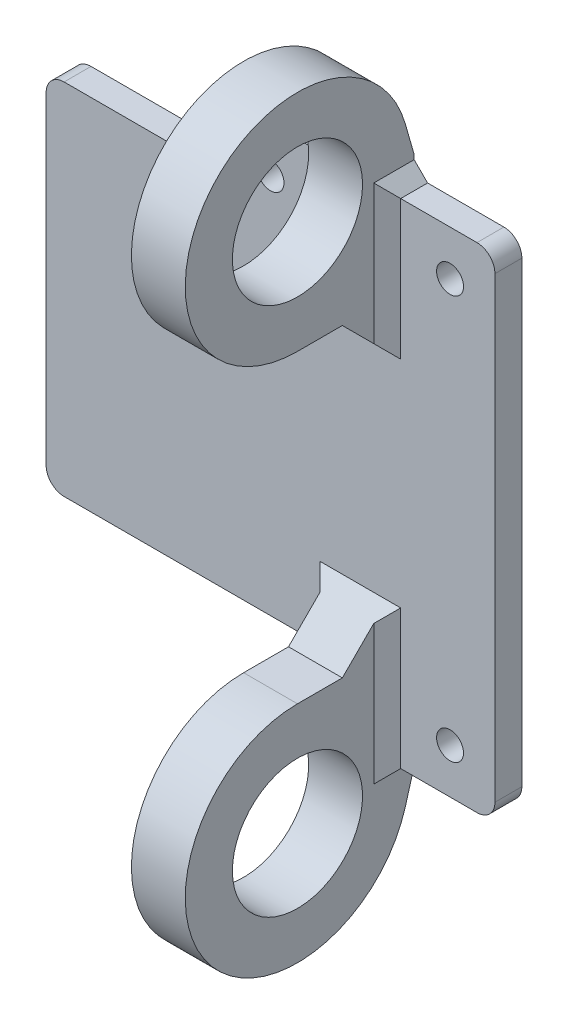
from build123d import *

# Parameters (mm, degrees)
SKETCH1_R           = 1.5
BOSS_EXTRUDE1_DEPTH = 3
FILLET1_R           = 2
BOSS_EXTRUDE2_START = 7
SKETCH2_R           = 7.25
BOSS_EXTRUDE2_DEPTH = 6
CHAMFER1_SIZE       = 2
CHAMFER2_SIZE       = 5
CHAMFER3_SIZE       = 1.5


with BuildPart() as part:
    # Sketch1 → Boss-Extrude1 (new body)
    with BuildSketch(Plane.XY):
        Polygon((10, -27.5), (25, -27.5), (25, 27.5), (-5, 27.5), (-5, 20), (-25, 20), (-25, -20), (10, -20), align=None)
        with Locations((0, 22.5)):
            Circle(SKETCH1_R, mode=Mode.SUBTRACT)
        with Locations((20, 22.5)):
            Circle(SKETCH1_R, mode=Mode.SUBTRACT)
        with Locations((20, -22.5)):
            Circle(SKETCH1_R, mode=Mode.SUBTRACT)
    extrude(amount=BOSS_EXTRUDE1_DEPTH)

    # Fillet1
    fillet1_edges = [part.edges().sort_by_distance(p)[0] for p in [
        (25, -27.5, 1.5),
        (-25, -20, 1.5),
        (-25, 20, 1.5),
        (25, 27.5, 1.5),
    ]]
    fillet(fillet1_edges, radius=FILLET1_R)

    # Sketch2 → Boss-Extrude2 (add)
    # profile 1 of 2: a face of its own
    with BuildSketch(Plane(origin=(0, 0, 0), x_dir=(0, 0, -1), z_dir=(1, 0, 0)).offset(BOSS_EXTRUDE2_START)):
        with BuildLine():
            Line((-13, 17), (0, 17))
            Line((0, 17), (0, 29.500000036))
            Line((0, 29.500000036), (-0.98076924, 32.933379086))
            ThreePointArc((-0.98076924, 32.933379086), (-22.979159247, 37.027707534), (-13, 17))
        make_face()
        with Locations((-13, 29.5)):
            Circle(SKETCH2_R, mode=Mode.SUBTRACT)
    # profile 2 of 2: a face of its own
    with BuildSketch(Plane(origin=(0, 0, 0), x_dir=(0, 0, -1), z_dir=(1, 0, 0)).offset(BOSS_EXTRUDE2_START)):
        with BuildLine():
            Line((0, -29.500000036), (-0.98076924, -32.933379086))
            ThreePointArc((-0.98076924, -32.933379086), (-22.979159247, -37.027707534), (-13, -17))
            Line((-13, -17), (0, -17))
            Line((0, -17), (0, -29.500000036))
        make_face()
        with Locations(Location((-13, -29.5, 0), (0, 0, 180))):
            Circle(SKETCH2_R, mode=Mode.SUBTRACT)
    extrude(amount=BOSS_EXTRUDE2_DEPTH)

    # Chamfer1
    chamfer1_edges = [part.edges().sort_by_distance(p)[0] for p in [
        (-5, 20, 1.5),
        (-5, 27.5, 1.5),
    ]]
    chamfer(chamfer1_edges, length=CHAMFER1_SIZE)

    # Chamfer2
    chamfer2_edges = [part.edges().sort_by_distance(p)[0] for p in [
        (10, -17, 3),
        (10, 17, 3),
    ]]
    chamfer(chamfer2_edges, length=CHAMFER2_SIZE)

    # Chamfer3
    chamfer3_edges = [part.edges().sort_by_distance(p)[0] for p in [
        (13, -27.5, 1.5),
        (7, -20, 1.5),
        (13, -19.75, 3),
        (7, -16, 3),
        (7, 27.5, 1.5),
        (13, 27.5, 1.5),
        (7, 19.75, 3),
        (13, 19.75, 3),
    ]]
    chamfer(chamfer3_edges, length=CHAMFER3_SIZE)


solid = part.part
